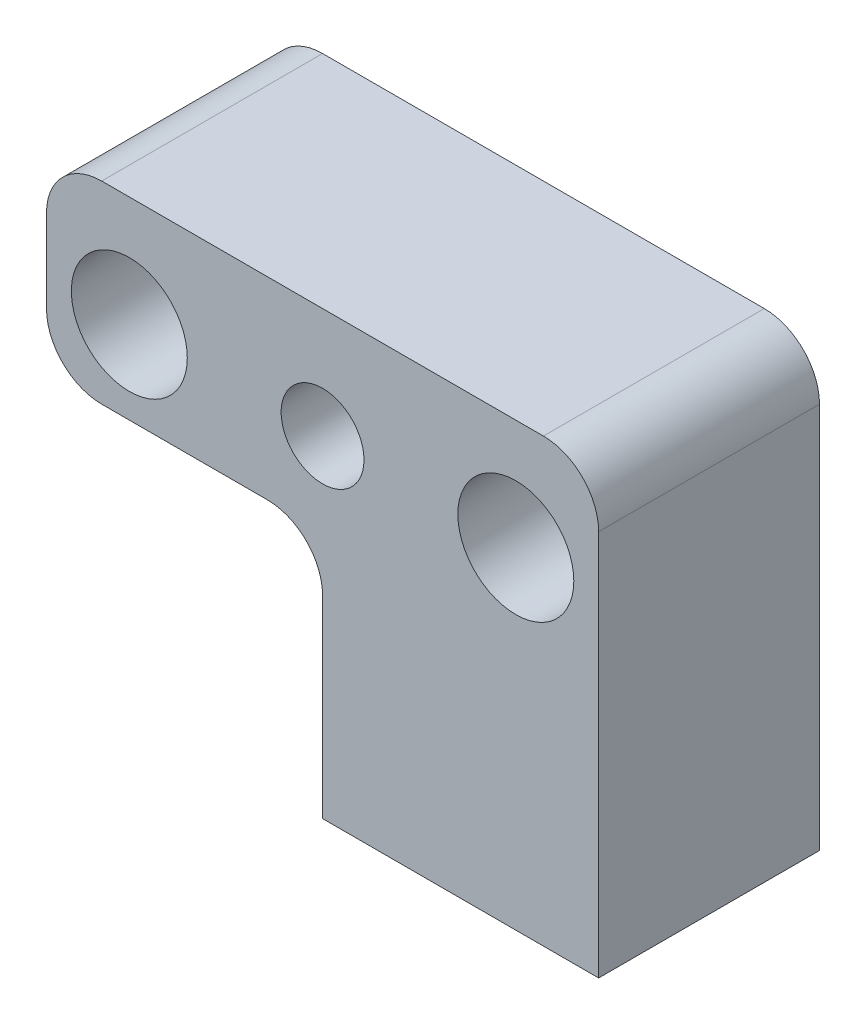
from build123d import *

# Parameters (mm, degrees)
SKETCH1_W           = 100
SKETCH1_H           = 80
BOSS_EXTRUDE1_DEPTH = 40
CUT_EXTRUDE1_REACH  = 77.498
SKETCH2_R           = 7.5
SKETCH2_R_2         = 10.5
CUT_EXTRUDE2_REACH  = 77.498
SKETCH3_W           = 100
SKETCH3_H           = 20
CUT_EXTRUDE4_REACH  = 77.498
SKETCH5_W           = 50
SKETCH5_H           = 25
FILLET1_R           = 10
FILLET2_R           = 10
FILLET3_R           = 10
FILLET4_R           = 10
SKETCH6_W           = 50
SKETCH6_H           = 40
BOSS_EXTRUDE2_DEPTH = 20
SKETCH4_R           = 3
CUT_EXTRUDE5_DEPTH  = 20


with BuildPart() as part:
    # Sketch1 → Boss-Extrude1 (new body)
    with BuildSketch(Plane.XY):
        Rectangle(SKETCH1_W, SKETCH1_H)
    extrude(amount=BOSS_EXTRUDE1_DEPTH)

    # Sketch2 → Cut-Extrude1 (cut, up to next)
    with BuildSketch(Plane.XY.offset(40), mode=Mode.PRIVATE) as cut_extrude1_sk1:
        Circle(SKETCH2_R)
    cut_extrude1_tool1 = extrude(cut_extrude1_sk1.sketch, amount=-CUT_EXTRUDE1_REACH, mode=Mode.PRIVATE) & part.part
    # Sketch2 → Cut-Extrude1 (cut, up to next)
    with BuildSketch(Plane.XY.offset(40), mode=Mode.PRIVATE) as cut_extrude1_sk2:
        with Locations((-35, 0)):
            Circle(SKETCH2_R_2)
    cut_extrude1_tool2 = extrude(cut_extrude1_sk2.sketch, amount=-CUT_EXTRUDE1_REACH, mode=Mode.PRIVATE) & part.part
    # Sketch2 → Cut-Extrude1 (cut, up to next)
    with BuildSketch(Plane.XY.offset(40), mode=Mode.PRIVATE) as cut_extrude1_sk3:
        with Locations((35, 0)):
            Circle(SKETCH2_R_2)
    cut_extrude1_tool3 = extrude(cut_extrude1_sk3.sketch, amount=-CUT_EXTRUDE1_REACH, mode=Mode.PRIVATE) & part.part
    add(cut_extrude1_tool1.solids().sort_by_distance((0, 0, 40))[0], mode=Mode.SUBTRACT)
    add(cut_extrude1_tool2.solids().sort_by_distance((-35, 0, 40))[0], mode=Mode.SUBTRACT)
    add(cut_extrude1_tool3.solids().sort_by_distance((35, 0, 40))[0], mode=Mode.SUBTRACT)

    # Sketch3 → Cut-Extrude2 (cut, up to next)
    with BuildSketch(Plane.XY.offset(40), mode=Mode.PRIVATE) as cut_extrude2_sk1:
        with Locations((0, 30)):
            Rectangle(SKETCH3_W, SKETCH3_H)
    cut_extrude2_tool1 = extrude(cut_extrude2_sk1.sketch, amount=-CUT_EXTRUDE2_REACH, mode=Mode.PRIVATE) & part.part
    add(cut_extrude2_tool1.solids().sort_by_distance((0, 30, 40))[0], mode=Mode.SUBTRACT)

    # Sketch5 → Cut-Extrude4 (cut, up to next)
    with BuildSketch(Plane(origin=(0, 0, 0), x_dir=(-1, 0, 0), z_dir=(0, 0, -1)), mode=Mode.PRIVATE) as cut_extrude4_sk1:
        with Locations((25, -27.5)):
            Rectangle(SKETCH5_W, SKETCH5_H)
    cut_extrude4_tool1 = extrude(cut_extrude4_sk1.sketch, amount=-CUT_EXTRUDE4_REACH, mode=Mode.PRIVATE) & part.part
    add(cut_extrude4_tool1.solids().sort_by_distance((-25, -27.5, 0))[0], mode=Mode.SUBTRACT)

    # Fillet1
    fillet1_edges = [part.edges().sort_by_distance(p)[0] for p in [
        (0, -15, 20),
    ]]
    fillet(fillet1_edges, radius=FILLET1_R)

    # Fillet2
    fillet2_edges = [part.edges().sort_by_distance(p)[0] for p in [
        (-50, -15, 20),
    ]]
    fillet(fillet2_edges, radius=FILLET2_R)

    # Fillet3
    fillet3_edges = [part.edges().sort_by_distance(p)[0] for p in [
        (-50, 20, 20),
    ]]
    fillet(fillet3_edges, radius=FILLET3_R)

    # Fillet4
    fillet4_edges = [part.edges().sort_by_distance(p)[0] for p in [
        (50, 20, 20),
    ]]
    fillet(fillet4_edges, radius=FILLET4_R)

    # Sketch6 → Boss-Extrude2 (add)
    with BuildSketch(Plane.XZ.offset(40)):
        with Locations((25, 20)):
            Rectangle(SKETCH6_W, SKETCH6_H)
    extrude(amount=BOSS_EXTRUDE2_DEPTH)

    # Sketch4 → Cut-Extrude5 (cut, symmetric)
    with BuildSketch(Plane.XZ.offset(40)):
        with Locations(Location((16, 20, 0), (0, 0, 180))):
            Circle(SKETCH4_R)
        with Locations(Location((36, 20, 0), (0, 0, 180))):
            Circle(SKETCH4_R)
    extrude(amount=CUT_EXTRUDE5_DEPTH, both=True, mode=Mode.SUBTRACT)


solid = part.part
